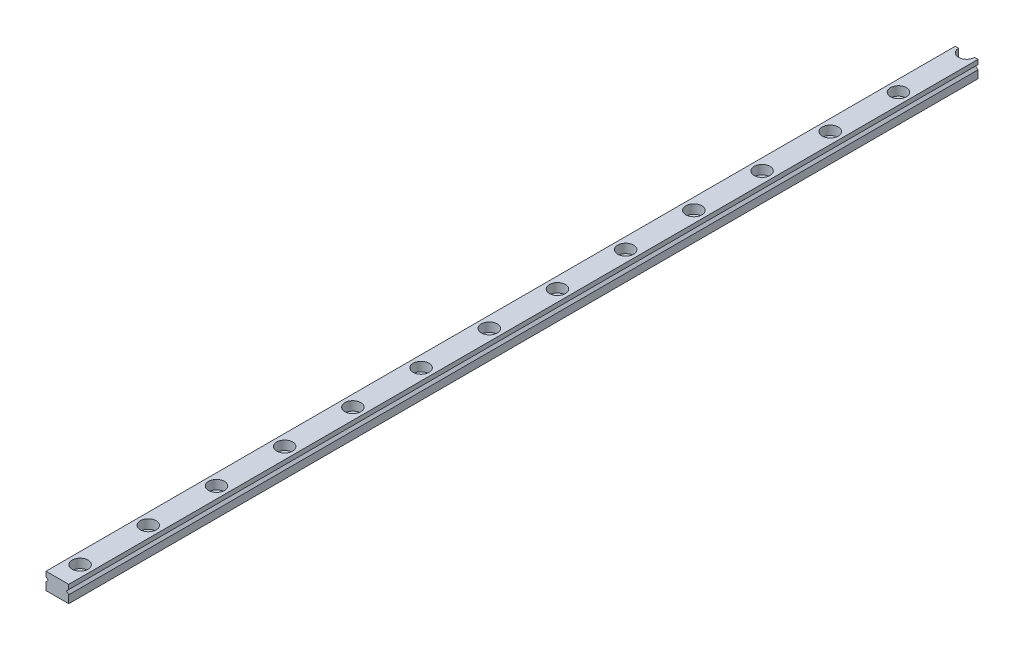
from build123d import *

# Parameters (mm, degrees)
SKETCH1_W           = 5
SKETCH1_H           = 3.7
BOSS_EXTRUDE1_DEPTH = 400
SKETCH2_R           = 1.75
CUT_EXTRUDE1_DEPTH  = 2
SKETCH3_R           = 1
CUT_EXTRUDE2_DEPTH  = 401.036248358
CUT_EXTRUDE3_DEPTH  = 401.048359577
SKETCH5_W           = 10.325646163
SKETCH5_H           = 6.55225139
CUT_EXTRUDE4_DEPTH  = 200


with BuildPart() as part:
    # Sketch1 → Boss-Extrude1 (new body)
    with BuildSketch(Plane.XY):
        with Locations((2.5, 1.85)):
            Rectangle(SKETCH1_W, SKETCH1_H)
    extrude(amount=-BOSS_EXTRUDE1_DEPTH)

    # Sketch2 → Cut-Extrude1 (cut)
    with BuildSketch(Plane(origin=(0, 3.7, 0), x_dir=(1, 0, 0), z_dir=(0, 1, 0))):
        with Locations(Location((2.5, 5, 0), (0, 0, 270))):
            Circle(SKETCH2_R)
        with Locations(Location((2.5, 20, 0), (0, 0, 270))):
            Circle(SKETCH2_R)
        with Locations(Location((2.5, 35, 0), (0, 0, 270))):
            Circle(SKETCH2_R)
        with Locations(Location((2.5, 50, 0), (0, 0, 270))):
            Circle(SKETCH2_R)
        with Locations(Location((2.5, 65, 0), (0, 0, 270))):
            Circle(SKETCH2_R)
        with Locations(Location((2.5, 80, 0), (0, 0, 270))):
            Circle(SKETCH2_R)
        with Locations(Location((2.5, 95, 0), (0, 0, 270))):
            Circle(SKETCH2_R)
        with Locations(Location((2.5, 110, 0), (0, 0, 270))):
            Circle(SKETCH2_R)
        with Locations(Location((2.5, 125, 0), (0, 0, 270))):
            Circle(SKETCH2_R)
        with Locations(Location((2.5, 140, 0), (0, 0, 270))):
            Circle(SKETCH2_R)
        with Locations(Location((2.5, 155, 0), (0, 0, 270))):
            Circle(SKETCH2_R)
        with Locations(Location((2.5, 170, 0), (0, 0, 270))):
            Circle(SKETCH2_R)
        with Locations(Location((2.5, 185, 0), (0, 0, 270))):
            Circle(SKETCH2_R)
        with Locations(Location((2.5, 200, 0), (0, 0, 270))):
            Circle(SKETCH2_R)
        with Locations(Location((2.5, 215, 0), (0, 0, 270))):
            Circle(SKETCH2_R)
        with Locations(Location((2.5, 230, 0), (0, 0, 270))):
            Circle(SKETCH2_R)
        with Locations(Location((2.5, 245, 0), (0, 0, 270))):
            Circle(SKETCH2_R)
        with Locations(Location((2.5, 260, 0), (0, 0, 270))):
            Circle(SKETCH2_R)
        with Locations(Location((2.5, 275, 0), (0, 0, 270))):
            Circle(SKETCH2_R)
        with Locations(Location((2.5, 290, 0), (0, 0, 270))):
            Circle(SKETCH2_R)
        with Locations(Location((2.5, 305, 0), (0, 0, 270))):
            Circle(SKETCH2_R)
        with Locations(Location((2.5, 320, 0), (0, 0, 270))):
            Circle(SKETCH2_R)
        with Locations(Location((2.5, 335, 0), (0, 0, 270))):
            Circle(SKETCH2_R)
        with Locations(Location((2.5, 350, 0), (0, 0, 270))):
            Circle(SKETCH2_R)
        with Locations(Location((2.5, 365, 0), (0, 0, 270))):
            Circle(SKETCH2_R)
        with Locations(Location((2.5, 380, 0), (0, 0, 270))):
            Circle(SKETCH2_R)
        with Locations(Location((2.5, 395, 0), (0, 0, 270))):
            Circle(SKETCH2_R)
    extrude(amount=-CUT_EXTRUDE1_DEPTH, mode=Mode.SUBTRACT)

    # Sketch3 → Cut-Extrude2 (cut, through all)
    with BuildSketch(Plane(origin=(0, 1.7, 0), x_dir=(1, 0, 0), z_dir=(0, 1, 0))):
        with Locations(Location((2.5, 5, 0), (0, 0, 270))):
            Circle(SKETCH3_R)
        with Locations(Location((2.5, 20, 0), (0, 0, 270))):
            Circle(SKETCH3_R)
        with Locations(Location((2.5, 35, 0), (0, 0, 270))):
            Circle(SKETCH3_R)
        with Locations(Location((2.5, 50, 0), (0, 0, 270))):
            Circle(SKETCH3_R)
        with Locations(Location((2.5, 65, 0), (0, 0, 270))):
            Circle(SKETCH3_R)
        with Locations(Location((2.5, 80, 0), (0, 0, 270))):
            Circle(SKETCH3_R)
        with Locations(Location((2.5, 95, 0), (0, 0, 270))):
            Circle(SKETCH3_R)
        with Locations(Location((2.5, 110, 0), (0, 0, 270))):
            Circle(SKETCH3_R)
        with Locations(Location((2.5, 125, 0), (0, 0, 270))):
            Circle(SKETCH3_R)
        with Locations(Location((2.5, 140, 0), (0, 0, 270))):
            Circle(SKETCH3_R)
        with Locations(Location((2.5, 155, 0), (0, 0, 270))):
            Circle(SKETCH3_R)
        with Locations(Location((2.5, 170, 0), (0, 0, 270))):
            Circle(SKETCH3_R)
        with Locations(Location((2.5, 185, 0), (0, 0, 270))):
            Circle(SKETCH3_R)
        with Locations(Location((2.5, 200, 0), (0, 0, 270))):
            Circle(SKETCH3_R)
        with Locations(Location((2.5, 215, 0), (0, 0, 270))):
            Circle(SKETCH3_R)
        with Locations(Location((2.5, 230, 0), (0, 0, 270))):
            Circle(SKETCH3_R)
        with Locations(Location((2.5, 245, 0), (0, 0, 270))):
            Circle(SKETCH3_R)
        with Locations(Location((2.5, 260, 0), (0, 0, 270))):
            Circle(SKETCH3_R)
        with Locations(Location((2.5, 275, 0), (0, 0, 270))):
            Circle(SKETCH3_R)
        with Locations(Location((2.5, 290, 0), (0, 0, 270))):
            Circle(SKETCH3_R)
        with Locations(Location((2.5, 305, 0), (0, 0, 270))):
            Circle(SKETCH3_R)
        with Locations(Location((2.5, 320, 0), (0, 0, 270))):
            Circle(SKETCH3_R)
        with Locations(Location((2.5, 335, 0), (0, 0, 270))):
            Circle(SKETCH3_R)
        with Locations(Location((2.5, 350, 0), (0, 0, 270))):
            Circle(SKETCH3_R)
        with Locations(Location((2.5, 365, 0), (0, 0, 270))):
            Circle(SKETCH3_R)
        with Locations(Location((2.5, 380, 0), (0, 0, 270))):
            Circle(SKETCH3_R)
        with Locations(Location((2.5, 395, 0), (0, 0, 270))):
            Circle(SKETCH3_R)
    extrude(amount=-CUT_EXTRUDE2_DEPTH, mode=Mode.SUBTRACT)

    # Sketch4 → Cut-Extrude3 (cut, through all)
    with BuildSketch(Plane.XY):
        Polygon((0, 2.7), (0.5, 2.2), (0, 1.7), align=None)
        Polygon((5, 2.7), (4.5, 2.2), (5, 1.7), align=None)
    extrude(amount=-CUT_EXTRUDE3_DEPTH, mode=Mode.SUBTRACT)

    # Sketch5 → Cut-Extrude4 (cut)
    with BuildSketch(Plane(origin=(0, 0, -400), x_dir=(-1, 0, 0), z_dir=(0, 0, -1))):
        with Locations((-2.428078688, 2.315270048)):
            Rectangle(SKETCH5_W, SKETCH5_H)
    extrude(amount=-CUT_EXTRUDE4_DEPTH, mode=Mode.SUBTRACT)


solid = part.part
